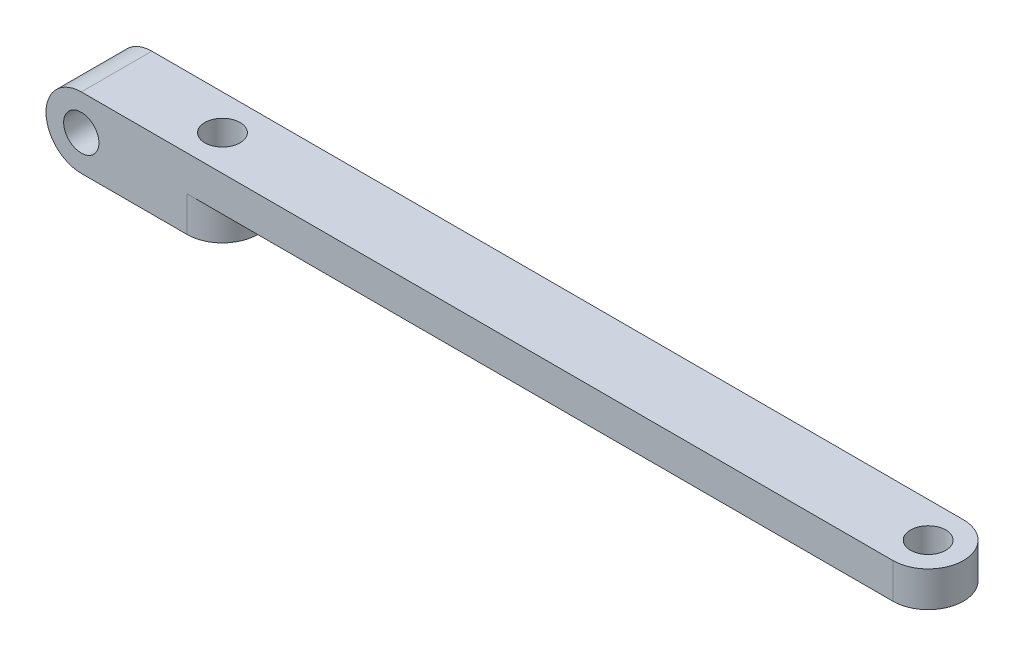
from build123d import *

# Parameters (mm, degrees)
SKETCH1_R           = 2
BOSS_EXTRUDE1_DEPTH = 4
BOSS_EXTRUDE2_START = -4
BOSS_EXTRUDE2_DEPTH = 4
SKETCH3_R           = 1
CUT_EXTRUDE1_DEPTH  = 6.385164807
SKETCH7_R           = 1
BOSS_EXTRUDE4_DEPTH = 2
SKETCH8_R           = 1
BOSS_EXTRUDE5_DEPTH = 2


with BuildPart() as part:
    # Sketch1 → Boss-Extrude1 (new body)
    with BuildSketch(Plane.XY):
        Circle(SKETCH1_R)
    extrude(amount=BOSS_EXTRUDE1_DEPTH)

    # Sketch2 → Boss-Extrude2 (add)
    with BuildSketch(Plane.XY.offset(4).offset(BOSS_EXTRUDE2_START)):
        with BuildLine():
            Line((3, 2), (0, 2))
            ThreePointArc((0, 2), (1.414213562, 1.414213562), (2, 0))
            ThreePointArc((2, 0), (1.414213562, -1.414213562), (0, -2))
            Line((0, -2), (3, -2))
            Line((3, -2), (3, 2))
        make_face()
    extrude(amount=BOSS_EXTRUDE2_DEPTH)

    # Sketch3 → Cut-Extrude1 (cut, through all)
    with BuildSketch(Plane.XY.offset(4)):
        Circle(SKETCH3_R)
    extrude(amount=-CUT_EXTRUDE1_DEPTH, mode=Mode.SUBTRACT)

    # Sketch7 → Boss-Extrude4 (add, symmetric)
    with BuildSketch(Plane(origin=(0, 0, 0), x_dir=(1, 0, 0), z_dir=(0, 1, 0))):
        with BuildLine():
            Line((3, 0), (3, -4))
            Line((3, -4), (6, -4))
            ThreePointArc((6, -4), (8, -2), (6, 0))
            Line((6, 0), (3, 0))
        make_face()
        with Locations(Location((6, -2, 0), (0, 0, 270))):
            Circle(SKETCH7_R, mode=Mode.SUBTRACT)
    extrude(amount=BOSS_EXTRUDE4_DEPTH, both=True)

    # Sketch8 → Boss-Extrude5 (add)
    with BuildSketch(Plane(origin=(0, 0, 0), x_dir=(1, 0, 0), z_dir=(0, 1, 0))):
        with BuildLine():
            Line((46, -4), (6, -4))
            ThreePointArc((6, -4), (4, -2), (6, 0))
            Line((6, 0), (46, 0))
            ThreePointArc((46, 0), (48, -2), (46, -4))
        make_face()
        with Locations(Location((46, -2, 0), (0, 0, 270))):
            Circle(SKETCH8_R, mode=Mode.SUBTRACT)
        with Locations(Location((6, -2, 0), (0, 0, 270))):
            Circle(SKETCH8_R, mode=Mode.SUBTRACT)
    extrude(amount=BOSS_EXTRUDE5_DEPTH)


solid = part.part
